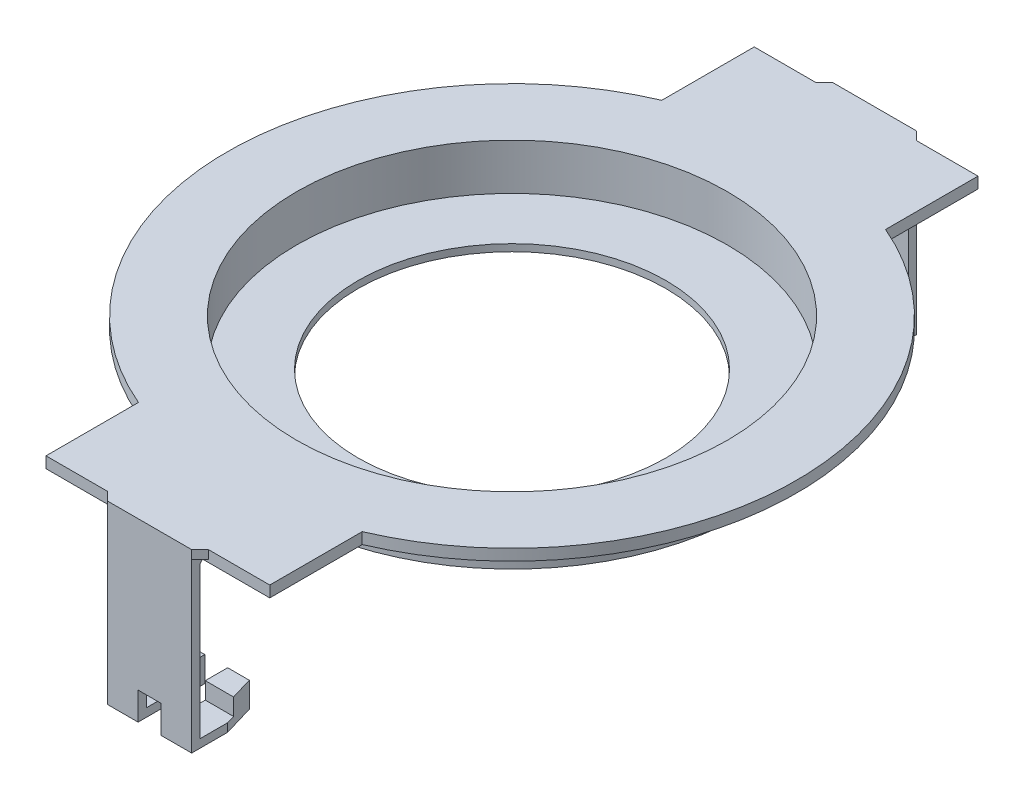
from build123d import *

# Parameters (mm, degrees)
SKETCH_1_R          = 38.5
SKETCH_1_R_2        = 27.5
EXTRUDE_1_DEPTH     = 1.25
SKETCH_3_W          = 126.6
SKETCH_3_H          = 126.6
SKETCH_3_R          = 38.5
EXTRUDE_2_DEPTH     = 2
EXTRUDE_3_REACH     = 92.022
SKETCH_4_R          = 42
SKETCH_4_R_2        = 38.5
EXTRUDE_4_DEPTH     = 1.5
SKETCH_6_W          = 5.5
SKETCH_6_H          = 1.485
EXTRUDE_5_DEPTH     = 6.43
SKETCH_7_W          = 5.5
SKETCH_7_H          = 4.5
EXTRUDE_6_DEPTH     = 4
CUT_EXTRUDE_1_DEPTH = 96.907142591
CUT_EXTRUDE_2_DEPTH = 10
EXTRUDE_7_DEPTH     = 15.08
EXTRUDE_8_DEPTH     = 1.5
EXTRUDE_9_DEPTH     = 1.5
SKETCH_17_W         = 5.5
SKETCH_17_H         = 1.485
EXTRUDE_10_DEPTH    = 6.43
SKETCH_18_W         = 5.5
SKETCH_18_H         = 4
EXTRUDE_12_DEPTH    = 4.5
CUT_EXTRUDE_3_DEPTH = 7
EXTRUDE_13_DEPTH    = 1.5
EXTRUDE_14_DEPTH    = 15.08


with BuildPart() as part:
    # 草圖1 → 填料-伸長1 (new body)
    with BuildSketch(Plane(origin=(0, 0, 0), x_dir=(1, 0, 0), z_dir=(0, 1, 0))):
        with Locations(Location((0, 0, 0), (0, 0, 270))):
            Circle(SKETCH_1_R)
        with Locations(Location((0, 0, 0), (0, 0, 270))):
            Circle(SKETCH_1_R_2, mode=Mode.SUBTRACT)
    extrude(amount=EXTRUDE_1_DEPTH)


with BuildPart() as body_2:
    # 草圖3 → 填料-伸長2 (new body)
    with BuildSketch(Plane(origin=(0, 7.5, 0), x_dir=(1, 0, 0), z_dir=(0, 1, 0))):
        Rectangle(SKETCH_3_W, SKETCH_3_H)
        with Locations(Location((0, 0, 0), (0, 0, 270))):
            Circle(SKETCH_3_R, mode=Mode.SUBTRACT)
    extrude(amount=EXTRUDE_2_DEPTH)

    # 草圖4 → 填料-伸長3 (add, up to next)
    with BuildSketch(Plane.XZ, mode=Mode.PRIVATE) as extrude_3_sk1:
        with Locations(Location((0, 0, 0), (0, 0, 270))):
            Circle(SKETCH_4_R)
        with Locations(Location((0, 0, 0), (0, 0, 90))):
            Circle(SKETCH_4_R_2, mode=Mode.SUBTRACT)
    extrude_3_tool1 = extrude(extrude_3_sk1.sketch, amount=-EXTRUDE_3_REACH, mode=Mode.PRIVATE) - body_2.part

    add(part.part)  # 填料-伸長3 merges part
    add(extrude_3_tool1.solids().sort_by_distance((0, 0, 40.812061))[0])

    # 草圖5 → 填料-伸長4 (add)
    with BuildSketch(Plane.XY.offset(63.3)):
        Polygon((-2.04, -22), (-2.04, -17.033321832), (2.04, -17.033321832), (2.04, -22), (7.54, -22), (7.54, 9.5), (-7.54, 9.5), (-7.54, -22), align=None)
    extrude(amount=EXTRUDE_4_DEPTH)

    # 草圖6 → 填料-伸長5 (add)
    with BuildSketch(Plane(origin=(0, 0, 63.3), x_dir=(-1, 0, 0), z_dir=(0, 0, -1))):
        with Locations((-4.79, -21.2575)):
            Rectangle(SKETCH_6_W, SKETCH_6_H)
        with Locations((4.79, -21.2575)):
            Rectangle(SKETCH_6_W, SKETCH_6_H)
    extrude(amount=EXTRUDE_5_DEPTH)

    # 草圖7 → 填料-伸長6 (add)
    with BuildSketch(Plane(origin=(0, 0, 56.87), x_dir=(-1, 0, 0), z_dir=(0, 0, -1))):
        with Locations((-4.79, -19.75)):
            Rectangle(SKETCH_7_W, SKETCH_7_H)
        with Locations((4.79, -19.75)):
            Rectangle(SKETCH_7_W, SKETCH_7_H)
    extrude(amount=EXTRUDE_6_DEPTH)

    # 草圖8 → 除料-伸長1 (cut, through all)
    with BuildSketch(Plane(origin=(0, 9.5, 0), x_dir=(1, 0, 0), z_dir=(0, 1, 0))):
        with BuildLine():
            Line((-20, 46.775506025), (-20, 63.3))
            Line((-20, 63.3), (-63.3, 63.3))
            Line((-63.3, 63.3), (-63.3, -63.3))
            Line((-63.3, -63.3), (-20, -63.3))
            Line((-20, -63.3), (-20, -50.871877928))
            Line((-20, -50.871877928), (-20, -46.775506025))
            ThreePointArc((-20, -46.775506025), (-50.871877928, 0), (-20, 46.775506025))
        make_face()
        with BuildLine():
            Line((63.3, 63.3), (20, 63.3))
            Line((20, 63.3), (20, 46.775506025))
            ThreePointArc((20, 46.775506025), (42.458129507, 28.022405369), (50.871877928, 0))
            ThreePointArc((50.871877928, 0), (42.458129507, -28.022405369), (20, -46.775506025))
            Line((20, -46.775506025), (20, -50.871877928))
            Line((20, -50.871877928), (20, -63.3))
            Line((20, -63.3), (63.3, -63.3))
            Line((63.3, -63.3), (63.3, 63.3))
        make_face()
    extrude(amount=-CUT_EXTRUDE_1_DEPTH, mode=Mode.SUBTRACT)

    # 草圖10 → 除料-伸長2 (cut)
    with BuildSketch(Plane.XZ.offset(22)):
        Polygon((5.908233118, 52.87), (7.54, 52.87), (7.54, 58.37), align=None)
        Polygon((-7.54, 58.37), (-6.0283181, 52.87), (-7.54, 52.87), align=None)
    extrude(amount=-CUT_EXTRUDE_2_DEPTH, mode=Mode.SUBTRACT)

    # 草圖12 → 填料-伸長7 (add)
    with BuildSketch(Plane(origin=(7.54, 0, 0), x_dir=(0, 0, -1), z_dir=(1, 0, 0))):
        Polygon((-62.506477542, 7.5), (-63.3, 7.5), (-63.3, 6.532326517), align=None)
    extrude(amount=-EXTRUDE_7_DEPTH)

    # 草圖14 → 填料-伸長8 (add)
    with BuildSketch(Plane(origin=(0, 9.5, 0), x_dir=(1, 0, 0), z_dir=(0, 1, 0))):
        Polygon((-7.54, -64.8), (-9.04, -63.3), (-7.54, -63.3), align=None)
        Polygon((7.54, -64.8), (7.54, -63.3), (9.04, -63.3), align=None)
    extrude(amount=-EXTRUDE_8_DEPTH)

    # 草圖16 → 填料-伸長9 (add)
    with BuildSketch(Plane(origin=(0, 0, -63.3), x_dir=(-1, 0, 0), z_dir=(0, 0, -1))):
        Polygon((0, 9.5), (-7.54, 9.5), (-7.54, -22), (-2.04, -22), (-2.04, -17.033321832), (2.04, -17.033321832), (2.04, -22), (7.54, -22), (7.54, 9.5), align=None)
    extrude(amount=EXTRUDE_9_DEPTH)

    # 草圖17 → 填料-伸長10 (add)
    with BuildSketch(Plane.XY.offset(-63.3)):
        Polygon((-7.54, -22), (-7.54, -20.5), (-2.04, -20.515), (-2.04, -22), align=None)
        with Locations((4.79, -21.2575)):
            Rectangle(SKETCH_17_W, SKETCH_17_H)
    extrude(amount=EXTRUDE_10_DEPTH)

    # 草圖18 → 填料-伸長12 (add)
    with BuildSketch(Plane.XZ.offset(22)):
        with Locations((-4.79, -54.87)):
            Rectangle(SKETCH_18_W, SKETCH_18_H)
        with Locations((4.79, -54.87)):
            Rectangle(SKETCH_18_W, SKETCH_18_H)
    extrude(amount=-EXTRUDE_12_DEPTH)

    # 草圖19 → 除料-伸長3 (cut)
    with BuildSketch(Plane.XZ.offset(22)):
        Polygon((-7.54, -52.87), (-7.54, -58.37), (-6.010077166, -52.87), align=None)
        Polygon((7.54, -52.87), (7.54, -58.37), (6.019440026, -52.87), align=None)
    extrude(amount=-CUT_EXTRUDE_3_DEPTH, mode=Mode.SUBTRACT)

    # 草圖21 → 填料-伸長13 (add)
    with BuildSketch(Plane(origin=(0, 9.5, 0), x_dir=(1, 0, 0), z_dir=(0, 1, 0))):
        Polygon((-7.54, 64.8), (-9.04, 63.3), (-7.54, 63.3), align=None)
        Polygon((7.54, 64.8), (9.04, 63.3), (7.54, 63.3), align=None)
    extrude(amount=-EXTRUDE_13_DEPTH)

    # 草圖23 → 填料-伸長14 (add)
    with BuildSketch(Plane.ZY.offset(7.54)):
        Polygon((-62.521922408, 7.5), (-63.3, 7.5), (-63.3, 6.53), align=None)
    extrude(amount=-EXTRUDE_14_DEPTH)


solid = body_2.part
